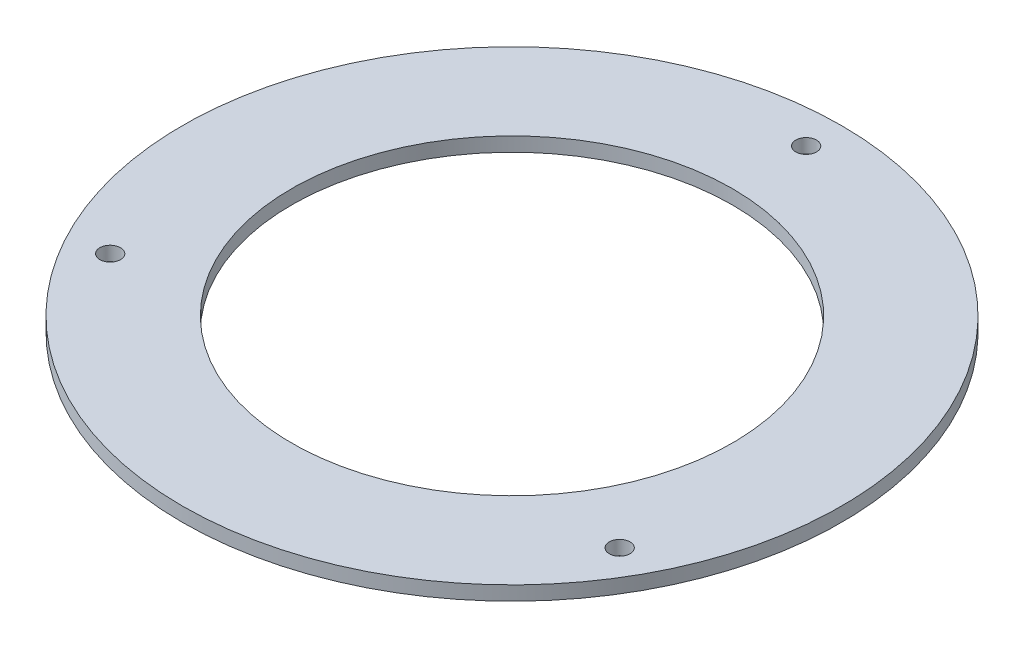
from build123d import *

# Parameters (mm, degrees)
SKETCH1_R           = 76.835
SKETCH1_R_2         = 2.413
SKETCH1_R_3         = 51.3842
BOSS_EXTRUDE1_DEPTH = 3.302


with BuildPart() as part:
    # Sketch1 → Boss-Extrude1 (new body)
    with BuildSketch(Plane(origin=(0, 0, 0), x_dir=(1, 0, 0), z_dir=(0, 1, 0))):
        with Locations(Location((0, 0, 0), (0, 0, 90))):
            Circle(SKETCH1_R)
        with Locations(Location((-59.392022192, -34.29, 0), (0, 0, 90))):
            Circle(SKETCH1_R_2, mode=Mode.SUBTRACT)
        with Locations(Location((59.392022192, -34.29, 0), (0, 0, 90))):
            Circle(SKETCH1_R_2, mode=Mode.SUBTRACT)
        with Locations(Location((0, 68.58, 0), (0, 0, 90))):
            Circle(SKETCH1_R_2, mode=Mode.SUBTRACT)
        with Locations(Location((0, 0, 0), (0, 0, 90))):
            Circle(SKETCH1_R_3, mode=Mode.SUBTRACT)
    extrude(amount=BOSS_EXTRUDE1_DEPTH)


solid = part.part
